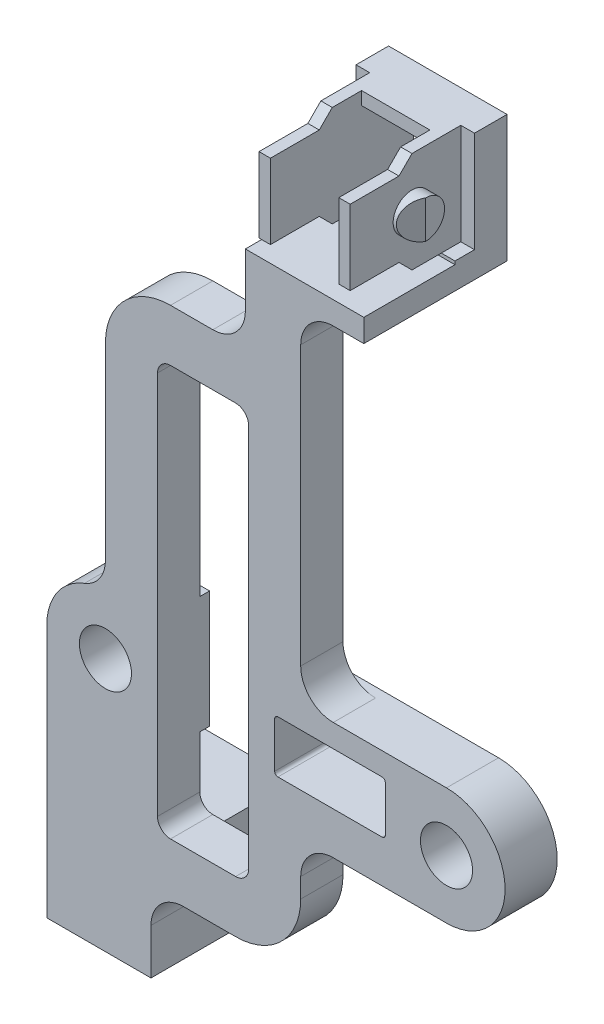
from build123d import *

# Parameters (mm, degrees)
SKETCH1_R           = 4
SKETCH1_W           = 10.5
SKETCH1_H           = 11.5
BOSS_EXTRUDE1_DEPTH = 22
CUT_EXTRUDE1_DEPTH  = 14
SKETCH5_W           = 17
SKETCH5_H           = 15.5
SKETCH5_R           = 2.9
CUT_EXTRUDE2_DEPTH  = 2.1
CUT_EXTRUDE3_START  = -2.1
SKETCH4_W           = 17
SKETCH4_H           = 15.5
SKETCH4_R           = 2.9
CUT_EXTRUDE3_DEPTH  = 2.1
CUT_EXTRUDE4_START  = -16.1
CUT_EXTRUDE4_DEPTH  = 14
CUT_EXTRUDE5_DEPTH  = 14
CUT_EXTRUDE6_REACH  = 138.799
CUT_EXTRUDE8_DEPTH  = 1.5


with BuildPart() as part:
    # Sketch1 → Boss-Extrude1 (new body)
    with BuildSketch(Plane.XY):
        with BuildLine():
            Line((0, 13.076696831), (0, 42))
            ThreePointArc((0, 42), (2.928932188, 49.071067812), (10, 52))
            Line((10, 52), (16.5, 52))
            ThreePointArc((16.5, 52), (20.035533906, 53.464466094), (21.5, 57))
            Line((21.5, 57), (21.5, 81.25))
            Line((21.5, 81.25), (39.7, 81.25))
            Line((39.7, 81.25), (39.7, 61.75))
            Line((39.7, 61.75), (35, 61.75))
            ThreePointArc((35, 61.75), (31.464466094, 60.285533906), (30, 56.75))
            Line((30, 56.75), (30, 14))
            ThreePointArc((30, 14), (31.464466094, 10.464466094), (35, 9))
            Line((35, 9), (52.4, 9))
            ThreePointArc((52.4, 9), (61.4, 0), (52.4, -9))
            Line((52.4, -9), (35, -9))
            ThreePointArc((35, -9), (31.464466094, -10.464466094), (30, -14))
            Line((30, -14), (30, -17))
            ThreePointArc((30, -17), (27.071067812, -24.071067812), (20, -27))
            Line((20, -27), (12, -27))
            ThreePointArc((12, -27), (8.464466094, -28.464466094), (7, -32))
            Line((7, -32), (7, -39))
            Line((7, -39), (-9, -39))
            Line((-9, -39), (-9, 0))
            ThreePointArc((-9, 0), (-7.413790239, 5.102520386), (-3.214285714, 8.406447963))
            ThreePointArc((-3.214285714, 8.406447963), (-0.881227645, 10.241963283), (0, 13.076696831))
        make_face()
        Circle(SKETCH1_R, mode=Mode.SUBTRACT)
        with Locations((52.4, 0)):
            Circle(SKETCH1_R, mode=Mode.SUBTRACT)
        with BuildLine():
            Line((42.5, -2.5), (26.5, -2.5))
            ThreePointArc((26.5, -2.5), (26.146446609, -2.353553391), (26, -2))
            Line((26, -2), (26, 5))
            ThreePointArc((26, 5), (26.146446609, 5.353553391), (26.5, 5.5))
            Line((26.5, 5.5), (42.5, 5.5))
            ThreePointArc((42.5, 5.5), (42.853553391, 5.353553391), (43, 5))
            Line((43, 5), (43, -2))
            ThreePointArc((43, -2), (42.853553391, -2.353553391), (42.5, -2.5))
        make_face(mode=Mode.SUBTRACT)
        with BuildLine():
            Line((8, 42), (8, -17))
            ThreePointArc((8, -17), (8.585786438, -18.414213562), (10, -19))
            Line((10, -19), (20, -19))
            ThreePointArc((20, -19), (21.414213562, -18.414213562), (22, -17))
            Line((22, -17), (22, 42))
            ThreePointArc((22, 42), (21.414213562, 43.414213562), (20, 44))
            Line((20, 44), (10, 44))
            ThreePointArc((10, 44), (8.585786438, 43.414213562), (8, 42))
        make_face(mode=Mode.SUBTRACT)
        with Locations((30.6, 73.5)):
            Rectangle(SKETCH1_W, SKETCH1_H, mode=Mode.SUBTRACT)
    extrude(amount=BOSS_EXTRUDE1_DEPTH)

    # Sketch3 → Cut-Extrude1 (cut)
    with BuildSketch(Plane(origin=(0, 0, 0), x_dir=(-1, 0, 0), z_dir=(0, 0, -1))):
        with BuildLine():
            Line((-21.5, 61.75), (-35, 61.75))
            ThreePointArc((-35, 61.75), (-31.464466094, 60.285533906), (-30, 56.75))
            Line((-30, 56.75), (-30, 14))
            ThreePointArc((-30, 14), (-31.464466094, 10.464466094), (-35, 9))
            Line((-35, 9), (-52.4, 9))
            ThreePointArc((-52.4, 9), (-61.4, 0), (-52.4, -9))
            Line((-52.4, -9), (-35, -9))
            ThreePointArc((-35, -9), (-31.464466094, -10.464466094), (-30, -14))
            Line((-30, -14), (-30, -17))
            ThreePointArc((-30, -17), (-27.071067812, -24.071067812), (-20, -27))
            Line((-20, -27), (-12, -27))
            ThreePointArc((-12, -27), (-8.464466094, -28.464466094), (-7, -32))
            Line((-7, -32), (-7, -23.75))
            Line((-7, -23.75), (9, -23.75))
            Line((9, -23.75), (9, 0))
            ThreePointArc((9, 0), (7.413790239, 5.102520386), (3.214285714, 8.406447963))
            ThreePointArc((3.214285714, 8.406447963), (0.881227645, 10.241963283), (0, 13.076696831))
            Line((0, 13.076696831), (0, 42))
            ThreePointArc((0, 42), (-2.928932188, 49.071067812), (-10, 52))
            Line((-10, 52), (-16.5, 52))
            ThreePointArc((-16.5, 52), (-20.035533906, 53.464466094), (-21.5, 57))
            Line((-21.5, 57), (-21.5, 61.75))
        make_face()
    extrude(amount=-CUT_EXTRUDE1_DEPTH, mode=Mode.SUBTRACT)

    # Sketch5 → Cut-Extrude2 (cut)
    with BuildSketch(Plane.ZY.offset(-21.5)):
        with Locations((13.5, 73.5)):
            Rectangle(SKETCH5_W, SKETCH5_H)
        with Locations(Location((12.5, 73.5, 0), (0, 0, 90))):
            Circle(SKETCH5_R, mode=Mode.SUBTRACT)
    extrude(amount=-CUT_EXTRUDE2_DEPTH, mode=Mode.SUBTRACT)

    # Sketch4 → Cut-Extrude3 (cut)
    with BuildSketch(Plane(origin=(39.7, 0, 0), x_dir=(0, 0, -1), z_dir=(1, 0, 0)).offset(CUT_EXTRUDE3_START)):
        with Locations((-13.5, 73.5)):
            Rectangle(SKETCH4_W, SKETCH4_H)
        with Locations(Location((-12.5, 73.5, 0), (0, 0, 90))):
            Circle(SKETCH4_R, mode=Mode.SUBTRACT)
    extrude(amount=CUT_EXTRUDE3_DEPTH, mode=Mode.SUBTRACT)

    # Sketch6 → Cut-Extrude4 (cut)
    with BuildSketch(Plane.ZY.offset(-21.5).offset(CUT_EXTRUDE4_START)):
        Polygon((12.5, 81.25), (14.5, 79.25), (22, 79.25), (22, 81.25), align=None)
        Polygon((12.5, 65.75), (14.5, 67.75), (22, 67.75), (22, 65.75), align=None)
    extrude(amount=CUT_EXTRUDE4_DEPTH, mode=Mode.SUBTRACT)

    # Sketch7 → Cut-Extrude5 (cut)
    with BuildSketch(Plane.XY.offset(22)):
        Polygon((25.35, 81.25), (35.85, 81.25), (35.85, 65.75), (39.7, 65.75), (39.7, 65.25), (21.5, 65.25), (21.5, 65.75), (25.35, 65.75), align=None)
    extrude(amount=-CUT_EXTRUDE5_DEPTH, mode=Mode.SUBTRACT)

    # Cut-Extrude6: up to this face of the body (flat: up to its plane)
    cut_extrude6_end = Plane(part.part.faces().sort_by_distance((22.55, 65.75, 6.5))[0])
    # Sketch8 → Cut-Extrude6 (cut, up to the picked face)
    with BuildSketch(Plane(origin=(0, 81.25, 0), x_dir=(1, 0, 0), z_dir=(0, 1, 0)), mode=Mode.PRIVATE) as cut_extrude6_sk1:
        Polygon((21.5, -12.5), (23.1, -15.4), (21.5, -15.4), align=None)
    cut_extrude6_tool1 = split(extrude(cut_extrude6_sk1.sketch, amount=-CUT_EXTRUDE6_REACH, mode=Mode.PRIVATE), bisect_by=cut_extrude6_end, keep=Keep.BOTH, mode=Mode.PRIVATE)
    # Sketch8 → Cut-Extrude6 (cut, up to the picked face)
    with BuildSketch(Plane(origin=(0, 81.25, 0), x_dir=(1, 0, 0), z_dir=(0, 1, 0)), mode=Mode.PRIVATE) as cut_extrude6_sk2:
        Polygon((39.7, -15.4), (38.1, -15.4), (39.7, -12.5), align=None)
    cut_extrude6_tool2 = split(extrude(cut_extrude6_sk2.sketch, amount=-CUT_EXTRUDE6_REACH, mode=Mode.PRIVATE), bisect_by=cut_extrude6_end, keep=Keep.BOTH, mode=Mode.PRIVATE)
    add(cut_extrude6_tool1.solids().sort_by(Axis((22.033333, 81.25, 14.433333), (0, -1, 0)))[0], mode=Mode.SUBTRACT)
    add(cut_extrude6_tool2.solids().sort_by(Axis((39.166667, 81.25, 14.433333), (0, -1, 0)))[0], mode=Mode.SUBTRACT)

    # Sketch10 → Cut-Extrude8 (cut)
    with BuildSketch(Plane(origin=(0, 0, 14), x_dir=(-1, 0, 0), z_dir=(0, 0, -1))):
        with BuildLine():
            Line((-35, 9), (2.105083257, 9))
            ThreePointArc((2.105083257, 9), (0.557332799, 10.782637515), (0, 13.076696831))
            Line((0, 13.076696831), (0, 42))
            ThreePointArc((0, 42), (-2.928932188, 49.071067812), (-10, 52))
            Line((-10, 52), (-16.5, 52))
            ThreePointArc((-16.5, 52), (-20.035533906, 53.464466094), (-21.5, 57))
            Line((-21.5, 57), (-21.5, 61.75))
            Line((-21.5, 61.75), (-35, 61.75))
            ThreePointArc((-35, 61.75), (-31.464466094, 60.285533906), (-30, 56.75))
            Line((-30, 56.75), (-30, 14))
            ThreePointArc((-30, 14), (-31.464466094, 10.464466094), (-35, 9))
        make_face()
        with BuildLine():
            Line((-35, -9), (0, -9))
            ThreePointArc((0, -9), (6.363961031, -6.363961031), (9, 0))
            Line((9, 0), (9, -23.75))
            Line((9, -23.75), (-7, -23.75))
            Line((-7, -23.75), (-7, -32))
            ThreePointArc((-7, -32), (-8.464466094, -28.464466094), (-12, -27))
            Line((-12, -27), (-20, -27))
            ThreePointArc((-20, -27), (-27.071067812, -24.071067812), (-30, -17))
            Line((-30, -17), (-30, -14))
            ThreePointArc((-30, -14), (-31.464466094, -10.464466094), (-35, -9))
        make_face()
    extrude(amount=-CUT_EXTRUDE8_DEPTH, mode=Mode.SUBTRACT)


solid = part.part
